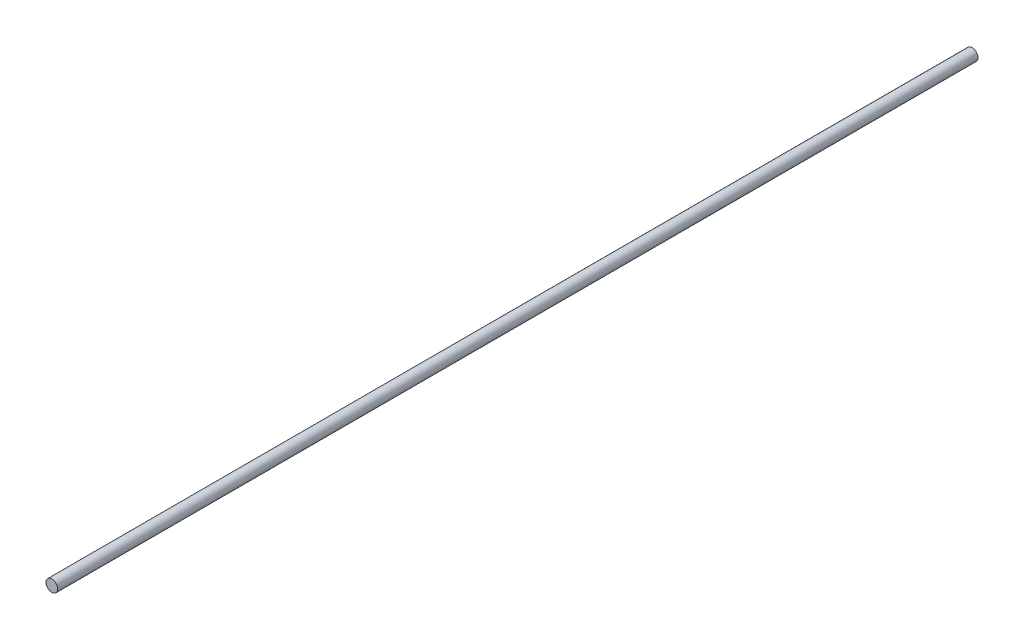
from build123d import *

# Parameters (mm, degrees)
SKETCH1_R           = 3.175
BOSS_EXTRUDE1_DEPTH = 500


with BuildPart() as part:
    # Sketch1 → Boss-Extrude1 (new body)
    with BuildSketch(Plane.XY):
        Circle(SKETCH1_R)
    extrude(amount=BOSS_EXTRUDE1_DEPTH)


solid = part.part
